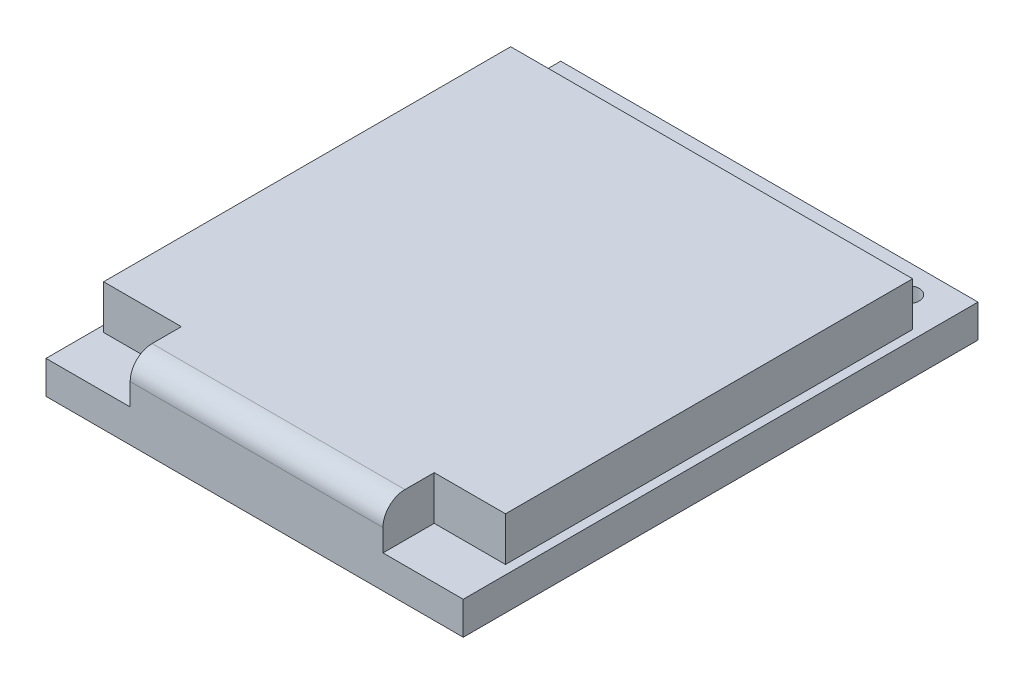
from build123d import *

# Parameters (mm, degrees)
SKETCH1_W           = 19
SKETCH1_H           = 23.44
SKETCH1_R           = 0.5
BOSS_EXTRUDE1_DEPTH = 1.5
BOSS_EXTRUDE2_DEPTH = 2
FILLET1_R           = 1


with BuildPart() as part:
    # Sketch1 → Boss-Extrude1 (new body)
    with BuildSketch(Plane(origin=(0, 0, 0), x_dir=(1, 0, 0), z_dir=(0, 1, 0))):
        with Locations((9.5, -11.72)):
            Rectangle(SKETCH1_W, SKETCH1_H)
        with Locations(Location((1.88, -1.3, 0), (0, 0, 270))):
            Circle(SKETCH1_R, mode=Mode.SUBTRACT)
        with Locations(Location((4.42, -1.3, 0), (0, 0, 270))):
            Circle(SKETCH1_R, mode=Mode.SUBTRACT)
        with Locations(Location((6.96, -1.3, 0), (0, 0, 270))):
            Circle(SKETCH1_R, mode=Mode.SUBTRACT)
        with Locations(Location((9.5, -1.3, 0), (0, 0, 270))):
            Circle(SKETCH1_R, mode=Mode.SUBTRACT)
        with Locations(Location((12.04, -1.3, 0), (0, 0, 270))):
            Circle(SKETCH1_R, mode=Mode.SUBTRACT)
        with Locations(Location((14.58, -1.3, 0), (0, 0, 270))):
            Circle(SKETCH1_R, mode=Mode.SUBTRACT)
        with Locations(Location((17.12, -1.3, 0), (0, 0, 270))):
            Circle(SKETCH1_R, mode=Mode.SUBTRACT)
    extrude(amount=BOSS_EXTRUDE1_DEPTH)

    # Sketch3 → Boss-Extrude2 (add)
    with BuildSketch(Plane(origin=(0, 1.5, 0), x_dir=(1, 0, 0), z_dir=(0, 1, 0))):
        Polygon((3.832385917, -21.106985825), (3.832385917, -23.44), (15.344727023, -23.44), (15.344727023, -21.106985825), (18.591797592, -21.106985825), (18.591797592, -2.569164761), (0.290127115, -2.569164761), (0.290127115, -21.106985825), align=None)
    extrude(amount=BOSS_EXTRUDE2_DEPTH)

    # Fillet1
    fillet1_edges = [part.edges().sort_by_distance(p)[0] for p in [
        (9.58855647, 3.5, 23.44),
    ]]
    fillet(fillet1_edges, radius=FILLET1_R)


solid = part.part
